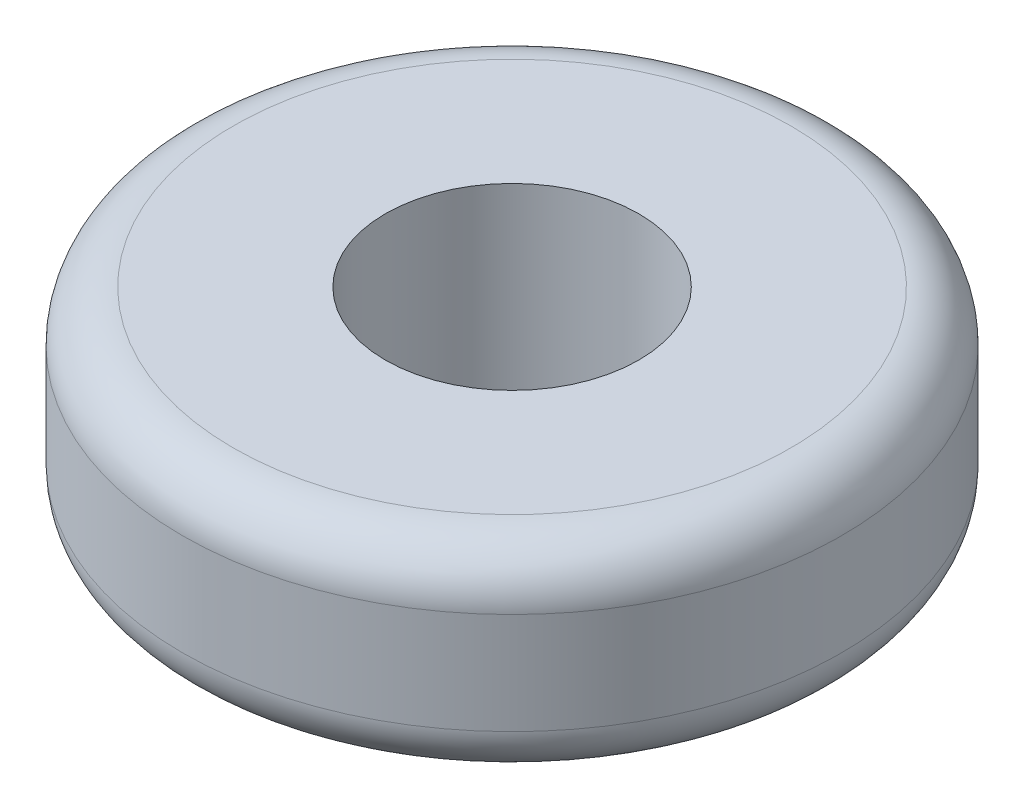
from build123d import *

# Parameters (mm, degrees)
SKETCH1_R           = 13
SKETCH1_R_2         = 5
BOSS_EXTRUDE1_DEPTH = 8
FILLET1_R           = 2


with BuildPart() as part:
    # Sketch1 → Boss-Extrude1 (new body)
    with BuildSketch(Plane(origin=(0, 0, 0), x_dir=(1, 0, 0), z_dir=(0, 1, 0))):
        with Locations(Location((0, 0, 0), (0, 0, 270))):
            Circle(SKETCH1_R)
        with Locations(Location((0, 0, 0), (0, 0, 270))):
            Circle(SKETCH1_R_2, mode=Mode.SUBTRACT)
    extrude(amount=BOSS_EXTRUDE1_DEPTH)

    # Fillet1
    fillet1_edges = [part.edges().sort_by_distance(p)[0] for p in [
        (0, 0, -13),
        (0, 8, -13),
    ]]
    fillet(fillet1_edges, radius=FILLET1_R)


solid = part.part
